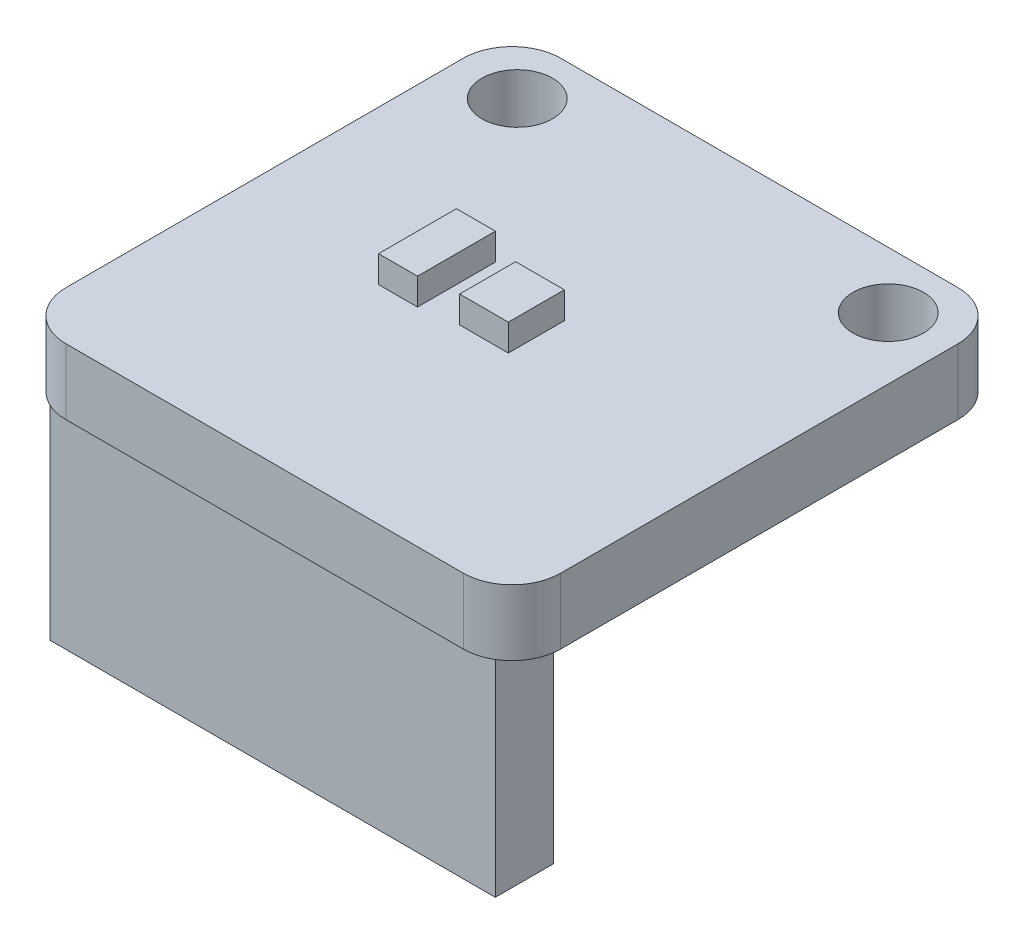
from build123d import *

# Parameters (mm, degrees)
ESQUISSE1_W        = 20.32
ESQUISSE1_H        = 20.32
BOSS_EXTRU_1_DEPTH = 2.7
D_GAGEMENT_M2_51_D = 2.9
ESQUISSE7_W        = 2
ESQUISSE7_H        = 2.3
ESQUISSE7_W_2      = 1.6
ESQUISSE7_H_2      = 3.2
BOSS_EXTRU_3_DEPTH = 1.1
ESQUISSE3_W        = 18.3
ESQUISSE3_H        = 2.4
BOSS_EXTRU_2_DEPTH = 8.5
CONG_1_R           = 2


with BuildPart() as part:
    # Esquisse1 → Boss.-Extru.1 (new body)
    with BuildSketch(Plane(origin=(0, 0, 0), x_dir=(1, 0, 0), z_dir=(0, 1, 0))):
        Rectangle(ESQUISSE1_W, ESQUISSE1_H)
    extrude(amount=BOSS_EXTRU_1_DEPTH)

    # Dégagement M2.51 (through all)
    with Locations(Plane(origin=(0, 2.7, 0), x_dir=(1, 0, 0), z_dir=(0, 1, 0))):
        with Locations((-7.62, 7.835000674), (7.62, 7.835000674)):
            Hole(D_GAGEMENT_M2_51_D / 2)

    # Esquisse7 → Boss.-Extru.3 (add)
    with BuildSketch(Plane(origin=(0, 2.7, 0), x_dir=(1, 0, 0), z_dir=(0, 1, 0))):
        with Locations((0.254, -0.254)):
            Rectangle(ESQUISSE7_W, ESQUISSE7_H)
        with Locations((-3.048, -0.034)):
            Rectangle(ESQUISSE7_W_2, ESQUISSE7_H_2)
    extrude(amount=BOSS_EXTRU_3_DEPTH)

    # Esquisse3 → Boss.-Extru.2 (add)
    with BuildSketch(Plane(origin=(0, 0, 0), x_dir=(1, 0, 0), z_dir=(0, 1, 0))):
        with Locations((0, -8.636)):
            Rectangle(ESQUISSE3_W, ESQUISSE3_H)
    extrude(amount=-BOSS_EXTRU_2_DEPTH)

    # Congé1
    cong_1_edges = [part.edges().sort_by_distance(p)[0] for p in [
        (-10.16, 1.35, -10.16),
        (10.16, 1.35, -10.16),
        (10.16, 1.35, 10.16),
        (-10.16, 1.35, 10.16),
    ]]
    fillet(cong_1_edges, radius=CONG_1_R)


solid = part.part
